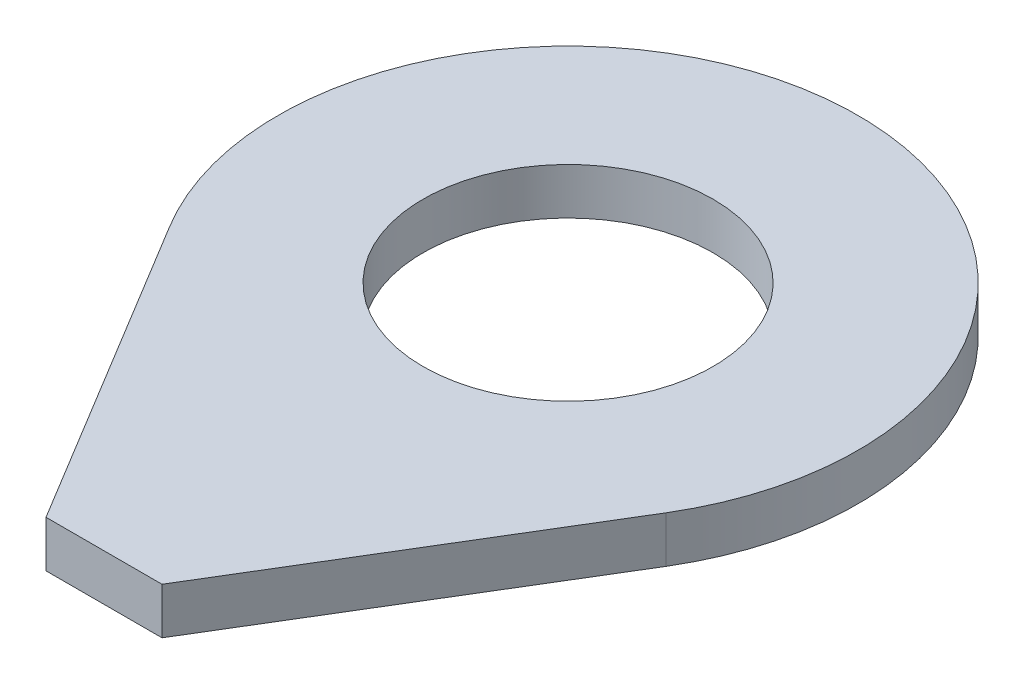
from build123d import *

# Parameters (mm, degrees)
SKETCH_1_R      = 2.5
EXTRUDE_1_DEPTH = 0.8


with BuildPart() as part:
    # 草图1 → 凸台-拉伸1 (new body)
    with BuildSketch(Plane(origin=(0, 0, 0), x_dir=(1, 0, 0), z_dir=(0, 1, 0))):
        with BuildLine():
            Line((-4.276649428, -2.590418822), (-1, -8))
            Line((-1, -8), (1, -8))
            Line((1, -8), (4.276649428, -2.590418822))
            ThreePointArc((4.276649428, -2.590418822), (0, 5), (-4.276649428, -2.590418822))
        make_face()
        with Locations(Location((0, 0, 0), (0, 0, 270))):
            Circle(SKETCH_1_R, mode=Mode.SUBTRACT)
    extrude(amount=EXTRUDE_1_DEPTH)


solid = part.part
